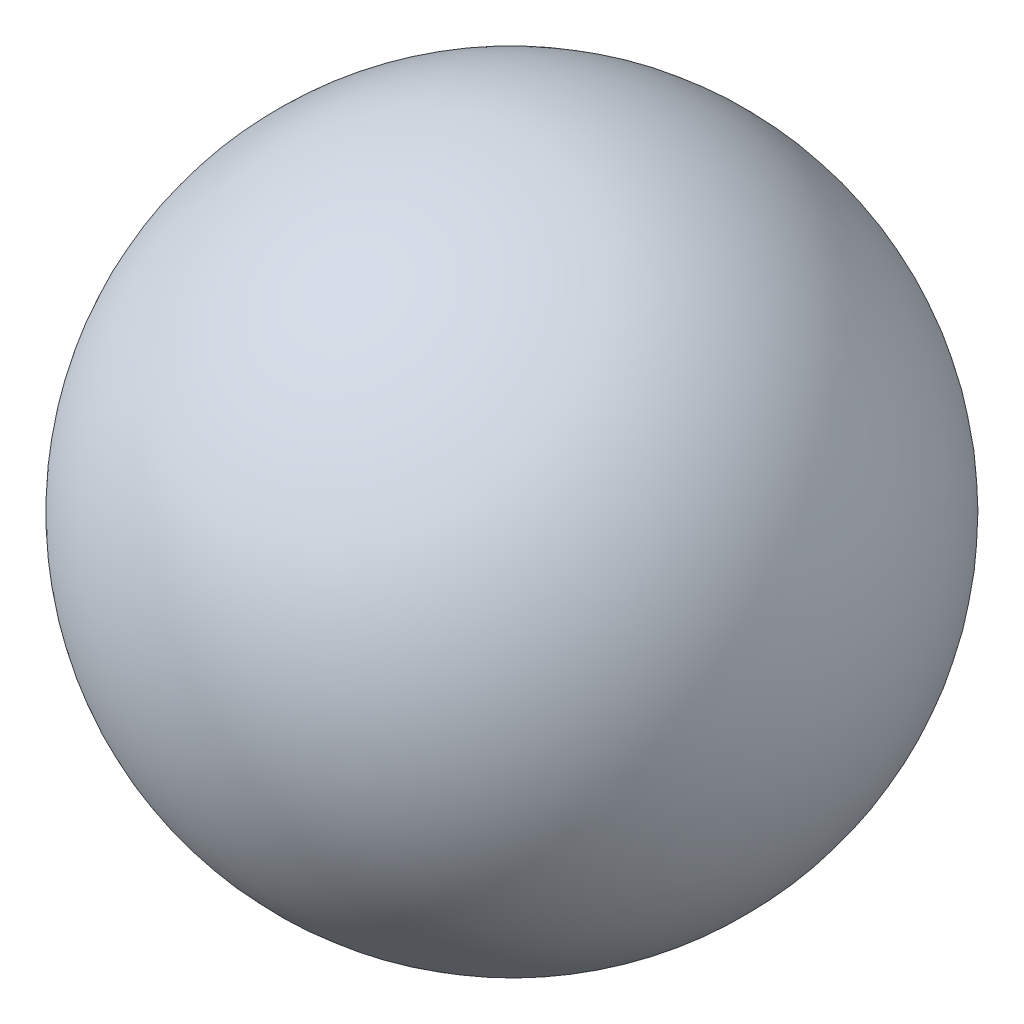
from build123d import *


with BuildPart() as part:
    # Sketch1 → Revolve1 (revolve)
    with BuildSketch(Plane(origin=(0, 0, 0), x_dir=(1, 0, 0), z_dir=(0, 1, 0))):
        with BuildLine():
            Line((15.2984755, -12.172064221), (-15.2984755, 12.172064221))
            ThreePointArc((-15.2984755, 12.172064221), (12.172064221, 15.2984755), (15.2984755, -12.172064221))
        make_face()
    revolve(axis=Axis((-15.2984755, 0, -12.172064221), (0.782530716087246, 0, 0.6226119805946415)))


solid = part.part
